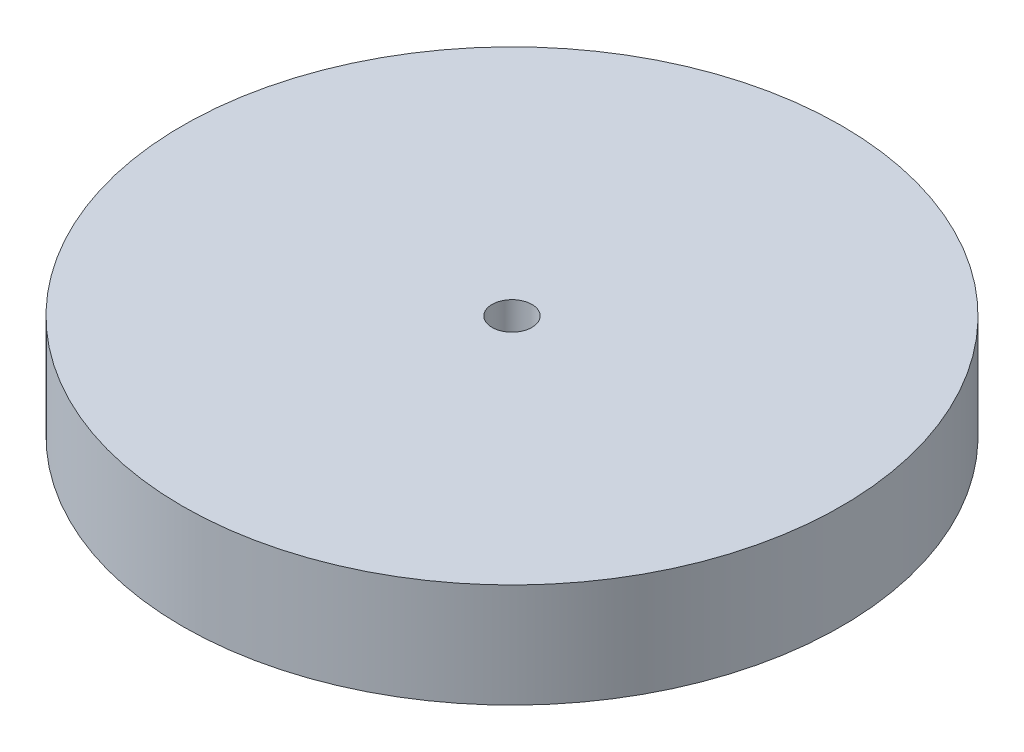
from build123d import *

# Parameters (mm, degrees)
SKETCH1_R           = 19
SKETCH1_R_2         = 1.15
BOSS_EXTRUDE1_DEPTH = 6


with BuildPart() as part:
    # Sketch1 → Boss-Extrude1 (new body)
    with BuildSketch(Plane(origin=(0, 0, 0), x_dir=(1, 0, 0), z_dir=(0, 1, 0))):
        with Locations(Location((0, 0, 0), (0, 0, 270))):
            Circle(SKETCH1_R)
        with Locations(Location((0, 0, 0), (0, 0, 270))):
            Circle(SKETCH1_R_2, mode=Mode.SUBTRACT)
    extrude(amount=-BOSS_EXTRUDE1_DEPTH)


solid = part.part
